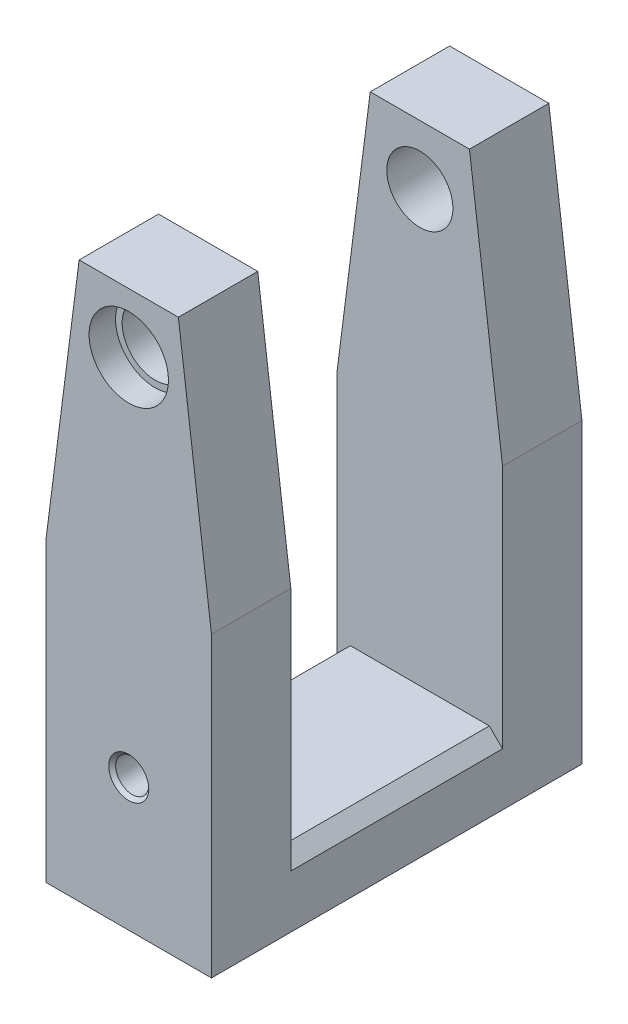
from build123d import *

# Parameters (mm, degrees)
BOSS_EXTRUDE1_DEPTH         = 28
SKETCH2_W                   = 32
SKETCH2_H                   = 74
CUT_EXTRUDE1_DEPTH          = 28
CHAMFER1_SIZE               = 2
HOLE1_D                     = 10
HOLE1_DEPTH                 = 12
HOLE1_CBORE_D               = 12
HOLE1_CBORE_DEPTH           = 4
M6_TAPPED_HOLE1_D           = 5
M6_TAPPED_HOLE1_DEPTH       = 27
M6_TAPPED_HOLE1_CSINK_D     = 6.05
M6_TAPPED_HOLE1_CSINK_ANGLE = 90
M6_TAPPED_HOLE1_TIP         = 1.502151548


with BuildPart() as part:
    # Sketch1 → Boss-Extrude1 (new, symmetric)
    with BuildSketch(Plane.XY):
        Polygon((-7.5, 42), (7.5, 42), (12.5, 3), (12.5, -42), (-12.5, -42), (-12.5, 3), align=None)
    extrude(amount=BOSS_EXTRUDE1_DEPTH, both=True)

    # Sketch2 → Cut-Extrude1 (cut, symmetric)
    with BuildSketch(Plane(origin=(0, 0, 0), x_dir=(0, 0, -1), z_dir=(1, 0, 0))):
        with Locations((0, 5)):
            Rectangle(SKETCH2_W, SKETCH2_H)
    extrude(amount=CUT_EXTRUDE1_DEPTH, both=True, mode=Mode.SUBTRACT)

    # Chamfer1
    chamfer1_edges = [part.edges().sort_by_distance(p)[0] for p in [
        (-12.5, -32, 0),
        (12.5, -32, 0),
    ]]
    chamfer(chamfer1_edges, length=CHAMFER1_SIZE)

    # Hole1
    with Locations(Plane.XY.offset(28)):
        with Locations((0, 33)):
            hole1 = CounterBoreHole(HOLE1_D / 2, HOLE1_CBORE_D / 2, HOLE1_CBORE_DEPTH, depth=HOLE1_DEPTH)

    # Mirror1: Hole1 across plane
    add(hole1.mirror(Plane.XY), mode=Mode.SUBTRACT)

    # M6 Tapped Hole1
    with Locations(Plane.XY.offset(28)):
        with Locations((0, -22)):
            CounterSinkHole(M6_TAPPED_HOLE1_D / 2, M6_TAPPED_HOLE1_CSINK_D / 2, depth=M6_TAPPED_HOLE1_DEPTH, counter_sink_angle=M6_TAPPED_HOLE1_CSINK_ANGLE)
            with Locations((0, 0, -(M6_TAPPED_HOLE1_DEPTH + M6_TAPPED_HOLE1_TIP / 2))):  # 118° drill point
                Cone(0, M6_TAPPED_HOLE1_D / 2, M6_TAPPED_HOLE1_TIP, mode=Mode.SUBTRACT)


solid = part.part
